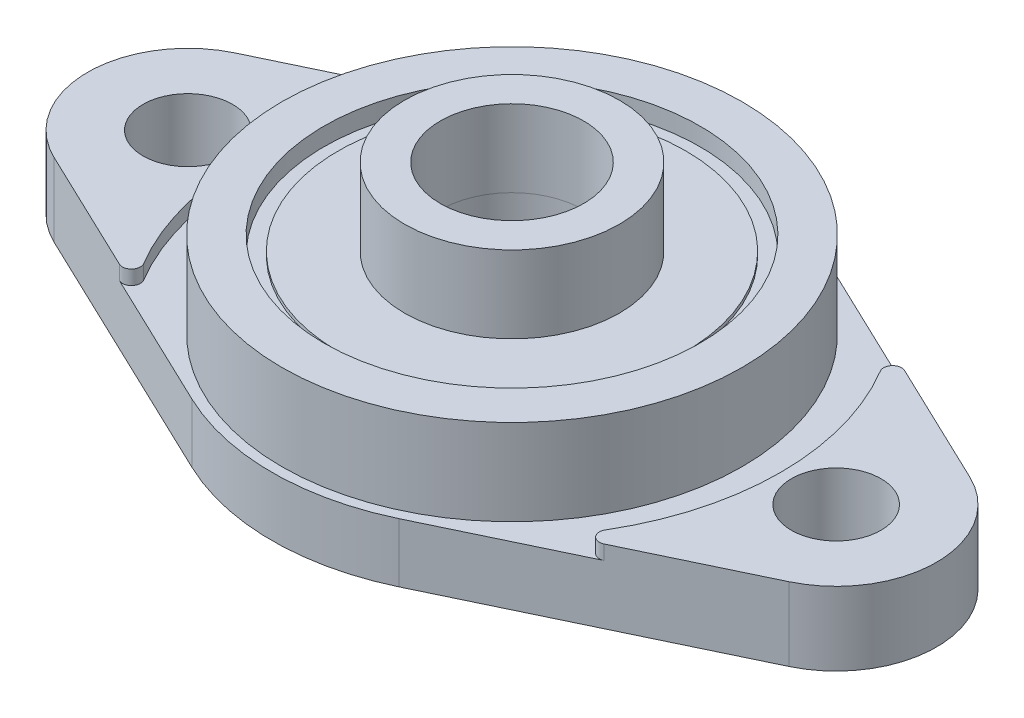
from build123d import *

# Parameters (mm, degrees)
SKETCH1_R            = 10.5
SKETCH1_R_2          = 2.500000000000003
SKETCH1_R_3          = 2.499999999999997
BOSS_EXTRUDE2_DEPTH  = 3.3
SKETCH2_R            = 2.4999999999999982
SKETCH2_R_2          = 2.500000000000002
BOSS_EXTRUDE3_DEPTH  = 0.8
FILLET1_R            = 0.5
SKETCH3_R            = 12.85
SKETCH3_R_2          = 10.5
BOSS_EXTRUDE4_DEPTH  = 4.8
SKETCH4_R            = 10.5
SKETCH4_R_2          = 9.700000000000001
BOSS_EXTRUDE5_DEPTH  = 7.1
SKETCH6_R            = 9.700000000000001
BOSS_EXTRUDE7_DEPTH  = 7.3
SKETCH7_R            = 6
CUT_EXTRUDE1_DEPTH   = 26.800000000000004
SKETCH8_R            = 6
BOSS_EXTRUDE8_DEPTH  = 7.3
SKETCH9_R            = 6.000000000000001
BOSS_EXTRUDE10_DEPTH = 4.3
SKETCH10_R           = 4
CUT_EXTRUDE2_DEPTH   = 25.300000000000004


with BuildPart() as part:
    # Sketch1 → Boss-Extrude2 (new body)
    with BuildSketch(Plane(origin=(0, 0, 0), x_dir=(1, 0, 0), z_dir=(0, 1, 0))):
        with BuildLine():
            ThreePointArc((20.513259668508287, -5.053333332796404), (23.699999999999996, 2e-15), (20.513259668508287, 5.05333333279641))
            Line((20.513259668508287, 5.053333332796416), (5.774585635359114, 12.091904760619984))
            ThreePointArc((5.774585635359115, 12.091904760619984), (-3.55e-15, 13.400000000000004), (-5.77458563535912, 12.09190476061998))
            Line((-5.774585635359118, 12.091904760619979), (-20.513259668508287, 5.053333332796407))
            ThreePointArc((-20.513259668508287, 5.053333332796408), (-23.699999999999996, 3.8e-16), (-20.51325966850829, -5.053333332796407))
            Line((-20.513259668508287, -5.053333332796406), (-5.7745856353591165, -12.091904760619977))
            ThreePointArc((-5.774585635359118, -12.091904760619983), (1.78e-15, -13.400000000000002), (5.774585635359122, -12.09190476061998))
            Line((5.77458563535912, -12.09190476061998), (20.51325966850829, -5.053333332796409))
        make_face()
        with Locations(Location((0, -4.4e-16, 0), (0, 0, 270))):
            Circle(SKETCH1_R, mode=Mode.SUBTRACT)
        with Locations(Location((18.1, 1.67e-15, 0), (0, 0, 270))):
            Circle(SKETCH1_R_2, mode=Mode.SUBTRACT)
        with Locations(Location((-18.099999999999994, -1.78e-15, 0), (0, 0, 270))):
            Circle(SKETCH1_R_3, mode=Mode.SUBTRACT)
    extrude(amount=BOSS_EXTRUDE2_DEPTH)

    # Sketch2 → Boss-Extrude3 (add)
    # profile 1 of 6: a face of its own
    with BuildSketch(Plane(origin=(0, 3.3, 0), x_dir=(1, 0, 0), z_dir=(0, 1, 0))):
        with BuildLine():
            Line((-11.857463280491546, 9.186977987989012), (-20.513259668508283, 5.053333332796408))
            ThreePointArc((-20.513259668508287, 5.053333332796406), (-17.32844759430292, 5.546594169872447), (-14.399171270718146, 4.202840315372693))
            ThreePointArc((-14.399171270718254, 4.202840315372694), (-13.36275127261764, 6.814460978401421), (-11.857463280491544, 9.186977987989017))
        make_face()
    # profile 2 of 6: a face of its own
    with BuildSketch(Plane(origin=(0, 3.3, 0), x_dir=(1, 0, 0), z_dir=(0, 1, 0))):
        with BuildLine():
            ThreePointArc((-14.399171270718146, 4.202840315372693), (-17.32844759430292, 5.546594169872447), (-20.513259668508287, 5.053333332796406))
            ThreePointArc((-20.513259668508287, 5.053333332796406), (-23.699999999999996, 3.8e-16), (-20.513259668508287, -5.053333332796405))
            ThreePointArc((-20.513259668508287, -5.053333332796405), (-17.328447594302915, -5.546594169872446), (-14.399171270718144, -4.2028403153726925))
            ThreePointArc((-14.399171270718258, -4.202840315372684), (-15, 1.84e-15), (-14.399171270718254, 4.202840315372694))
        make_face()
        with Locations(Location((-18.099999999999998, -3.1e-16, 0), (0, 0, 270))):
            Circle(SKETCH2_R, mode=Mode.SUBTRACT)
    # profile 3 of 6: a face of its own
    with BuildSketch(Plane(origin=(0, 3.3, 0), x_dir=(1, 0, 0), z_dir=(0, 1, 0))):
        with BuildLine():
            ThreePointArc((-14.399171270718144, -4.2028403153726925), (-17.328447594302915, -5.546594169872446), (-20.513259668508287, -5.053333332796405))
            Line((-20.513259668508283, -5.053333332796404), (-11.857463280491546, -9.186977987989014))
            ThreePointArc((-11.857463280491546, -9.186977987989014), (-13.362751272617642, -6.814460978401417), (-14.399171270718258, -4.202840315372684))
        make_face()
    # profile 4 of 6: a face of its own
    with BuildSketch(Plane(origin=(0, 3.3, 0), x_dir=(1, 0, 0), z_dir=(0, 1, 0))):
        with BuildLine():
            ThreePointArc((14.399171270718256, -4.202840315372689), (13.362751272617636, -6.814460978401428), (11.857463280491539, -9.186977987989023))
            Line((11.857463280491542, -9.186977987989021), (20.51325966850829, -5.053333332796405))
            ThreePointArc((20.513259668508294, -5.053333332796405), (17.32844759430292, -5.5465941698724475), (14.39917127071814, -4.202840315372691))
        make_face()
    # profile 5 of 6: a face of its own
    with BuildSketch(Plane(origin=(0, 3.3, 0), x_dir=(1, 0, 0), z_dir=(0, 1, 0))):
        with BuildLine():
            Line((20.513259668508287, 5.053333332796412), (11.857463280491546, 9.18697798798902))
            ThreePointArc((11.857463280491544, 9.186977987989017), (13.36275127261764, 6.814460978401421), (14.399171270718254, 4.202840315372695))
            ThreePointArc((14.399171270718142, 4.202840315372697), (17.328447594302915, 5.546594169872453), (20.51325966850829, 5.05333333279641))
        make_face()
    # profile 6 of 6: a face of its own
    with BuildSketch(Plane(origin=(0, 3.3, 0), x_dir=(1, 0, 0), z_dir=(0, 1, 0))):
        with BuildLine():
            ThreePointArc((23.7, 2.87e-15), (22.83678446541778, 2.987117829643953), (20.51325966850829, 5.05333333279641))
            ThreePointArc((20.51325966850829, 5.05333333279641), (17.328447594302915, 5.546594169872453), (14.399171270718142, 4.202840315372697))
            ThreePointArc((14.399171270718254, 4.202840315372695), (14.849033117694463, 2.1227848382756775), (15, 0))
            ThreePointArc((15, -3.67e-15), (14.849033117694463, -2.122784838275676), (14.399171270718256, -4.202840315372689))
            ThreePointArc((14.39917127071814, -4.202840315372691), (17.32844759430292, -5.5465941698724475), (20.513259668508294, -5.053333332796405))
            ThreePointArc((20.513259668508294, -5.053333332796405), (22.83678446541778, -2.9871178296439473), (23.7, 1.49e-15))
        make_face()
        with Locations(Location((18.099999999999998, 2.87e-15, 0), (0, 0, 270))):
            Circle(SKETCH2_R_2, mode=Mode.SUBTRACT)
    extrude(amount=BOSS_EXTRUDE3_DEPTH)

    # Fillet1
    fillet1_edges = [part.edges().sort_by_distance(p)[0] for p in [
        (-11.857463280491544, 3.6999999999999997, -9.186977987989016),
        (-11.857463280491547, 3.6999999999999997, 9.186977987989014),
        (11.85746328049154, 3.6999999999999997, 9.186977987989021),
        (11.857463280491544, 3.6999999999999997, -9.186977987989017),
    ]]
    fillet(fillet1_edges, radius=FILLET1_R)

    # Sketch3 → Boss-Extrude4 (add)
    with BuildSketch(Plane(origin=(0, 3.3, 0), x_dir=(1, 0, 0), z_dir=(0, 1, 0))):
        with Locations(Location((0, 0, 0), (0, 0, 270))):
            Circle(SKETCH3_R)
        with Locations(Location((0, 0, 0), (0, 0, 270))):
            Circle(SKETCH3_R_2, mode=Mode.SUBTRACT)
    extrude(amount=BOSS_EXTRUDE4_DEPTH)

    # Sketch4 → Boss-Extrude5 (add)
    with BuildSketch(Plane.XZ):
        with Locations(Location((0, 0, 0), (0, 0, 90))):
            Circle(SKETCH4_R)
        with Locations(Location((0, 0, 0), (0, 0, 270))):
            Circle(SKETCH4_R_2, mode=Mode.SUBTRACT)
    extrude(amount=-BOSS_EXTRUDE5_DEPTH)

    # Sketch6 → Boss-Extrude7 (add)
    with BuildSketch(Plane.XZ):
        with Locations(Location((0, 0, 0), (0, 0, 90))):
            Circle(SKETCH6_R)
    extrude(amount=-BOSS_EXTRUDE7_DEPTH)

    # Sketch7 → Cut-Extrude1 (cut)
    with BuildSketch(Plane(origin=(0, 7.299999999999999, 0), x_dir=(1, 0, 0), z_dir=(0, 1, 0))):
        with Locations(Location((0, 0, 0), (0, 0, 270))):
            Circle(SKETCH7_R)
    extrude(amount=-CUT_EXTRUDE1_DEPTH, mode=Mode.SUBTRACT)


with BuildPart() as body_2:
    # Sketch8 → Boss-Extrude8 (new body)
    with BuildSketch(Plane.XZ):
        with Locations(Location((0, 0, 0), (0, 0, 270))):
            Circle(SKETCH8_R)
    extrude(amount=-BOSS_EXTRUDE8_DEPTH)


with BuildPart() as body_3:
    # Sketch9 → Boss-Extrude10 (new body)
    with BuildSketch(Plane(origin=(0, 7.299999999999999, 0), x_dir=(1, 0, 0), z_dir=(0, 1, 0))):
        with Locations(Location((0, 0, 0), (0, 0, 90))):
            Circle(SKETCH9_R)
    extrude(amount=BOSS_EXTRUDE10_DEPTH)


with BuildPart() as cut_extrude2_tool:
    # Sketch10 → Cut-Extrude2 (new body)
    with BuildSketch(Plane(origin=(0, 11.6, 0), x_dir=(1, 0, 0), z_dir=(0, 1, 0))):
        with Locations(Location((0, 0, 0), (0, 0, 270))):
            Circle(SKETCH10_R)
    extrude(amount=-CUT_EXTRUDE2_DEPTH)


with BuildPart() as body_2_1:
    add(body_2.part)

    # Cut-Extrude2: cut by cut_extrude2_tool
    add(cut_extrude2_tool.part, mode=Mode.SUBTRACT)


with BuildPart() as body_3_1:
    add(body_3.part)

    # Cut-Extrude2: cut by cut_extrude2_tool
    add(cut_extrude2_tool.part, mode=Mode.SUBTRACT)


solid = Compound([part.part, body_2_1.part, body_3_1.part])
